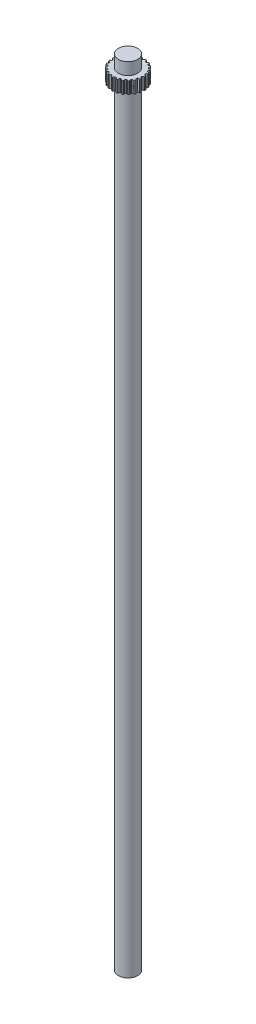
from build123d import *

# Parameters (mm, degrees)
SKETCH1_R                = 6
SKETCH1_R_2              = 4
BOSS_EXTRUDE1_DEPTH      = 5
BOSS_EXTRUDE2_DEPTH      = 5
FILLET1_R                = 0.1
CIRPATTERN2_COUNT        = 23
FILLET1_OF_CIRPATTERN2_R = 0.1
BOSS_EXTRUDE3_DEPTH      = 320
BOSS_EXTRUDE3_DEPTH_BACK = 10
SKETCH3_R                = 4


with BuildPart() as part:
    # Sketch1 → Boss-Extrude1 (new body)
    with BuildSketch(Plane(origin=(0, 0, 0), x_dir=(1, 0, 0), z_dir=(0, 1, 0))):
        with Locations(Location((0, 0, 0), (0, 0, 270))):
            Circle(SKETCH1_R)
        with Locations(Location((0, 0, 0), (0, 0, 270))):
            Circle(SKETCH1_R_2, mode=Mode.SUBTRACT)
    extrude(amount=BOSS_EXTRUDE1_DEPTH)

    # Sketch2 → Boss-Extrude2 (add)
    with BuildSketch(Plane.XZ):
        with BuildLine():
            Line((-0.35, 6.67), (0.35, 6.67))
            add(Edge.make_bspline(
                [(0.605, 5.969419989), (0.320724112, 6.265897205), (0.35, 6.67)],
                knots=[0, 0, 0, 1, 1, 1], degree=2))
            Line((0.605, 5.969419989), (0.637444252, 5.692244917))
            Line((0.637444252, 5.692244917), (-0.605, 5.692244917))
            Line((-0.605, 5.692244917), (-0.605, 5.969419989))
            add(Edge.make_bspline(
                [(-0.605, 5.969419989), (-0.320724112, 6.265897205), (-0.35, 6.67)],
                knots=[0, 0, 0, 1, 1, 1], degree=2))
        make_face()
    boss_extrude2 = extrude(amount=-BOSS_EXTRUDE2_DEPTH)

    # Fillet1
    fillet1_edges = [part.edges().sort_by_distance(p)[0] for p in [
        (-0.35, 2.5, 6.67),
        (0.35, 2.5, 6.67),
    ]]
    fillet(fillet1_edges, radius=FILLET1_R)

    # CirPattern2: Boss-Extrude2 ×23 about axis
    cirpattern2_axis = Axis((0, 0, 0), (0, 1, 0))
    for i in range(1, CIRPATTERN2_COUNT):
        add(boss_extrude2.rotate(cirpattern2_axis, i * 360 / CIRPATTERN2_COUNT))

    # Fillet1 of CirPattern2
    fillet1_of_cirpattern2_edges = [part.edges().sort_by_distance(p)[0] for p in [
        (1.462523413, 2.5, 6.517087177),
        (2.136565514, 2.5, 6.328229437),
        (3.166578155, 2.5, 5.880831811),
        (3.764671738, 2.5, 5.517123046),
        (4.635782282, 2.5, 4.808422053),
        (5.113569482, 2.5, 4.296836878),
        (5.761171644, 2.5, 3.379393628),
        (6.08321717, 2.5, 2.757873975),
        (6.45928126, 2.5, 1.699731038),
        (6.601700469, 2.5, 1.014372176),
        (6.678335535, 2.5, -0.105992828),
        (6.630565846, 2.5, -0.804360966),
        (6.402088215, 2.5, -1.90385569),
        (6.167672486, 2.5, -2.563438336),
        (5.651027299, 2.5, -3.560518286),
        (5.247351074, 2.5, -4.132397211),
        (4.48085554, 2.5, -4.953113528),
        (3.937857637, 2.5, -5.39487509),
        (2.978359225, 2.5, -5.978359),
        (2.336311314, 2.5, -6.257239762),
        (1.254971631, 2.5, -6.560216933),
        (0.561491468, 2.5, -6.655533587),
        (-0.561491468, 2.5, -6.655533587),
        (-1.254971631, 2.5, -6.560216933),
        (-2.336311314, 2.5, -6.257239762),
        (-2.978359225, 2.5, -5.978359),
        (-3.937857637, 2.5, -5.39487509),
        (-4.48085554, 2.5, -4.953113528),
        (-5.247351074, 2.5, -4.132397211),
        (-5.651027299, 2.5, -3.560518286),
        (-6.167672486, 2.5, -2.563438336),
        (-6.402088215, 2.5, -1.90385569),
        (-6.630565846, 2.5, -0.804360966),
        (-6.678335535, 2.5, -0.105992828),
        (-6.601700469, 2.5, 1.014372176),
        (-6.45928126, 2.5, 1.699731038),
        (-6.08321717, 2.5, 2.757873975),
        (-5.761171644, 2.5, 3.379393628),
        (-5.113569482, 2.5, 4.296836878),
        (-4.635782282, 2.5, 4.808422053),
        (-3.764671738, 2.5, 5.517123046),
        (-3.166578155, 2.5, 5.880831811),
        (-2.136565514, 2.5, 6.328229437),
        (-1.462523413, 2.5, 6.517087177),
    ]]
    fillet(fillet1_of_cirpattern2_edges, radius=FILLET1_OF_CIRPATTERN2_R)

    # Sketch3 → Boss-Extrude3 (add, two sides: drawn at the far end of the back side and taken through both)
    with BuildSketch(Plane.XZ.offset(-BOSS_EXTRUDE3_DEPTH_BACK)):
        with Locations(Location((0, 0, 0), (0, 0, 270))):
            Circle(SKETCH3_R)
    extrude(amount=BOSS_EXTRUDE3_DEPTH + BOSS_EXTRUDE3_DEPTH_BACK)


solid = part.part
